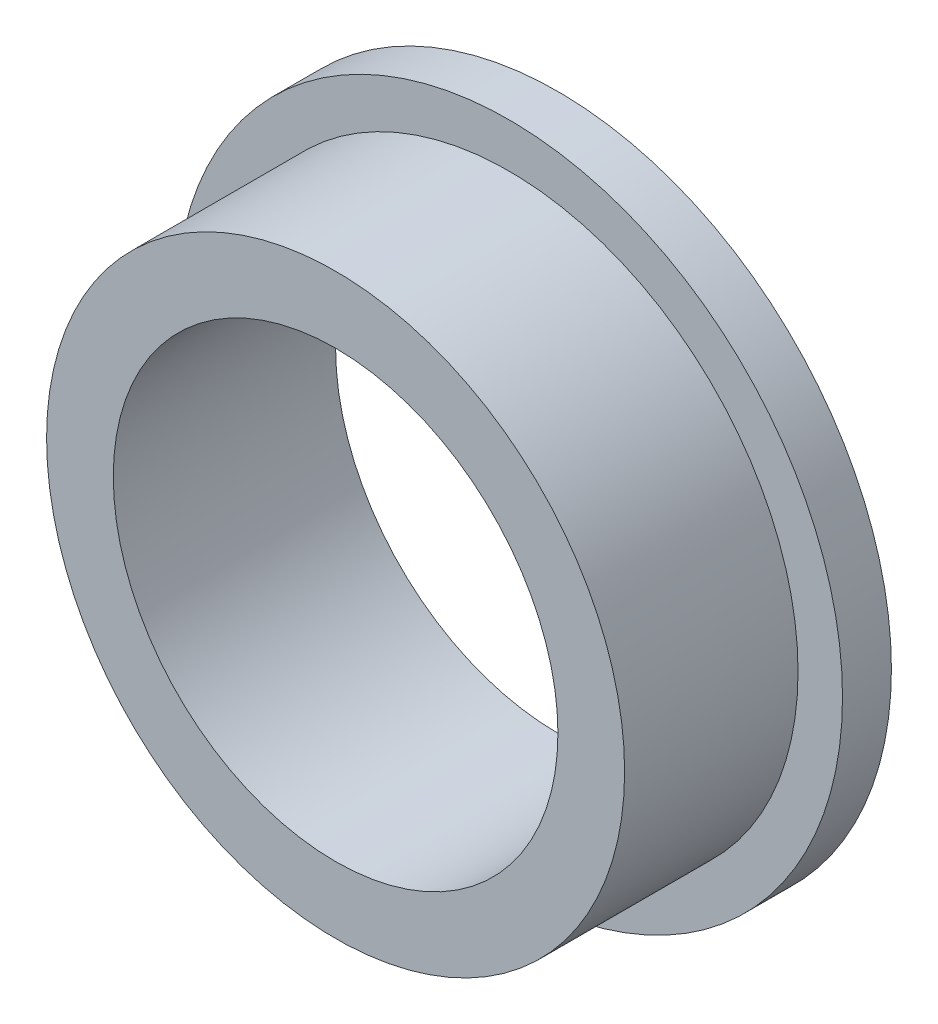
from build123d import *

# Parameters (mm, degrees)
SKETCH_1_R      = 6.5
SKETCH_1_R_2    = 5
EXTRUDE_1_DEPTH = 5
SKETCH_2_R      = 7.5
SKETCH_2_R_2    = 6.5
EXTRUDE_2_DEPTH = 1.1


with BuildPart() as part:
    # 草图1 → 凸台-拉伸1 (new body)
    with BuildSketch(Plane.XY):
        Circle(SKETCH_1_R)
        Circle(SKETCH_1_R_2, mode=Mode.SUBTRACT)
    extrude(amount=EXTRUDE_1_DEPTH)

    # 草图2 → 凸台-拉伸2 (add)
    with BuildSketch(Plane.XY):
        Circle(SKETCH_2_R)
        Circle(SKETCH_2_R_2, mode=Mode.SUBTRACT)
    extrude(amount=EXTRUDE_2_DEPTH)


solid = part.part
